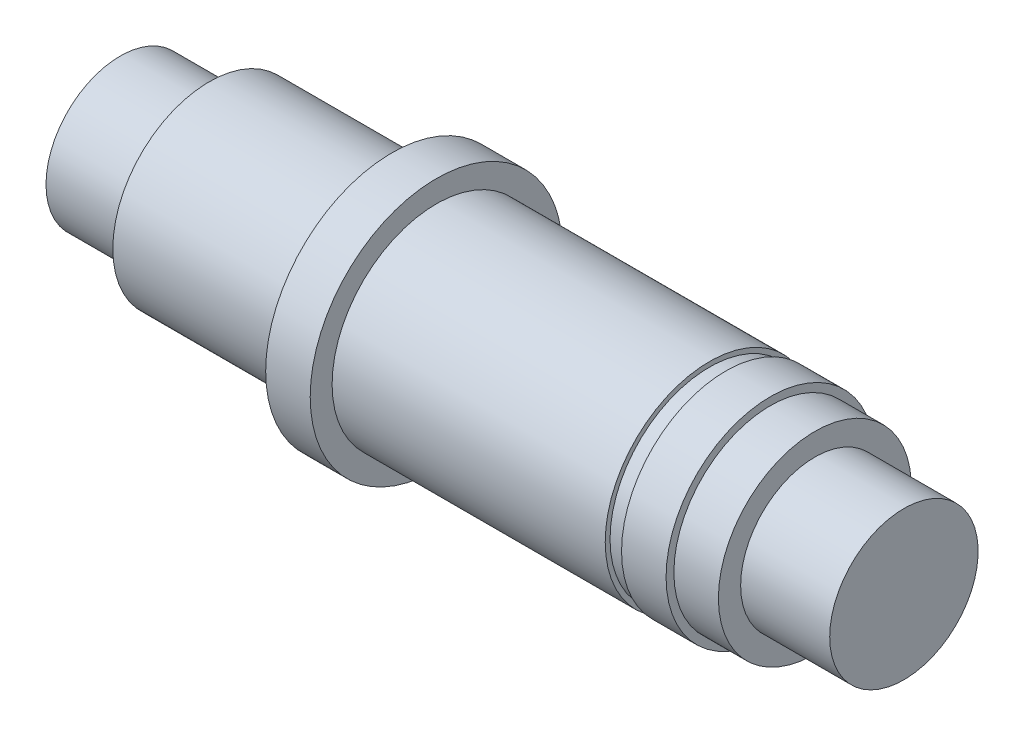
from build123d import *


with BuildPart() as part:
    # Sketch1 → Revolve1 (revolve)
    with BuildSketch(Plane.XY, mode=Mode.PRIVATE) as revolve1_sk:
        Polygon((0, 5), (0, 0), (52.8, 0), (52.8, 5), (46.8, 5), (46.8, 6.5), (43.8, 6.5), (43.8, 7.025), (40.8, 7.025), (40.8, 6.7), (39.7, 6.7), (39.7, 7.025), (21.3, 7.025), (21.3, 8.5), (18.3, 8.5), (18.3, 6.5), (6, 6.5), (6, 5), align=None)
    revolve(revolve1_sk.sketch.rotate(Axis((-13.668520122, 0, 0), (1, 0, 0)), 90), axis=Axis((-13.668520122, 0, 0), (1, 0, 0)))


solid = part.part
